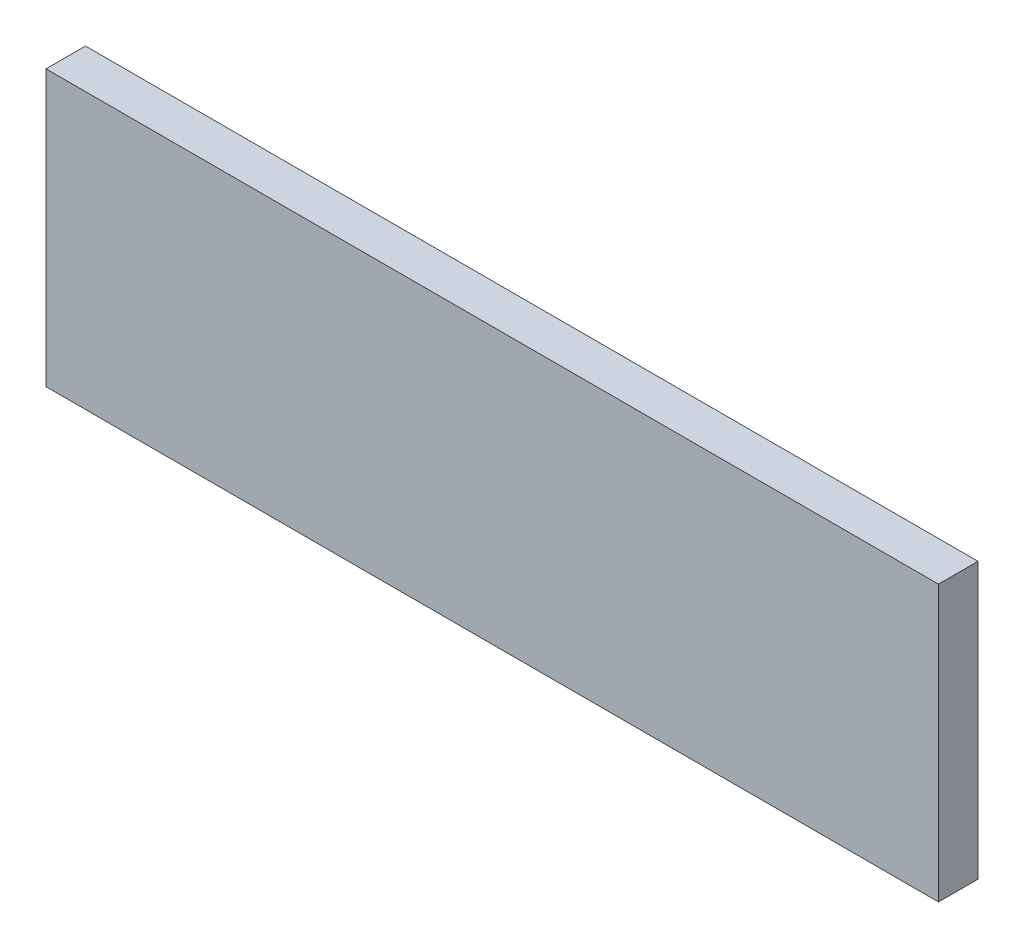
from build123d import *

# Parameters (mm, degrees)
SKETCH1_W           = 275.6
SKETCH1_H           = 85
BOSS_EXTRUDE1_DEPTH = 12.2


with BuildPart() as part:
    # Sketch1 → Boss-Extrude1 (new body)
    with BuildSketch(Plane.XY):
        Rectangle(SKETCH1_W, SKETCH1_H)
    extrude(amount=BOSS_EXTRUDE1_DEPTH)


solid = part.part
